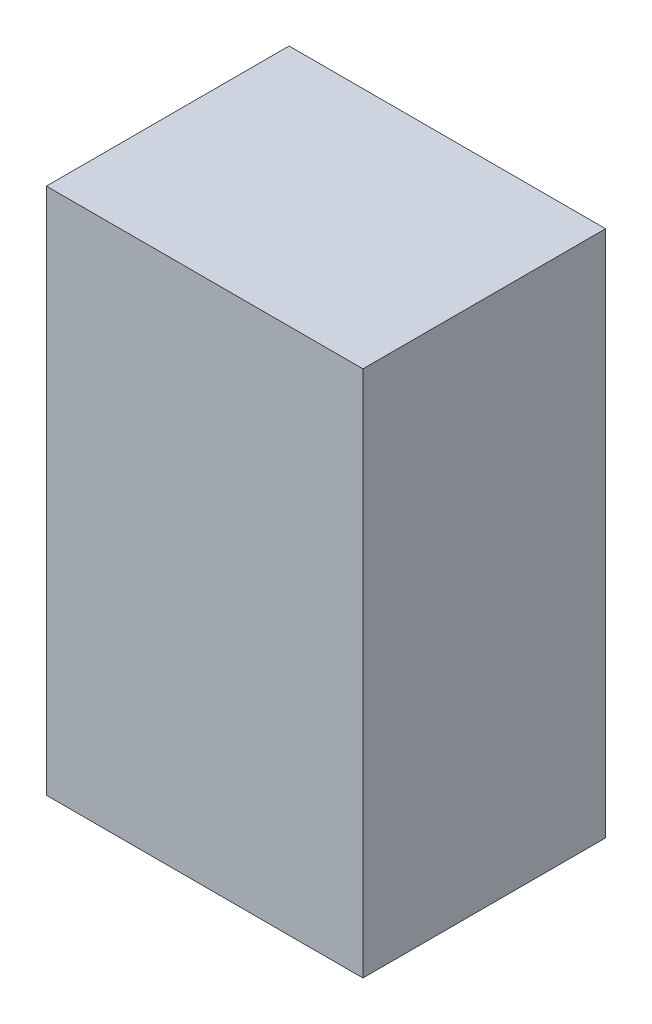
from build123d import *

# Parameters (mm, degrees)
SKETCH1_W           = 30
SKETCH1_H           = 23
BOSS_EXTRUDE1_DEPTH = 50
CUT_EXTRUDE2_START  = 2.5
SKETCH1_5_W         = 25
SKETCH1_5_H         = 18
CUT_EXTRUDE2_DEPTH  = 45
BOSS_EXTRUDE3_START = 25
SKETCH1_6_W         = 25
SKETCH1_6_H         = 18
BOSS_EXTRUDE3_DEPTH = 1
CUT_EXTRUDE3_START  = 21.5
SKETCH2_R           = 2.5
CUT_EXTRUDE3_DEPTH  = 26
SKETCH4_W           = 25
SKETCH4_H           = 5
CUT_EXTRUDE4_DEPTH  = 1


with BuildPart() as part:
    # Sketch1 → Boss-Extrude1 (new body)
    with BuildSketch(Plane(origin=(0, 0, 0), x_dir=(1, 0, 0), z_dir=(0, 1, 0))):
        Rectangle(SKETCH1_W, SKETCH1_H)
    extrude(amount=BOSS_EXTRUDE1_DEPTH)

    # Sketch1<5> → Cut-Extrude2 (cut)
    with BuildSketch(Plane(origin=(0, 0, 0), x_dir=(1, 0, 0), z_dir=(0, 1, 0)).offset(CUT_EXTRUDE2_START)):
        Rectangle(SKETCH1_5_W, SKETCH1_5_H)
    extrude(amount=CUT_EXTRUDE2_DEPTH, mode=Mode.SUBTRACT)

    # Sketch1<6> → Boss-Extrude3 (add)
    with BuildSketch(Plane(origin=(0, 0, 0), x_dir=(1, 0, 0), z_dir=(0, 1, 0)).offset(BOSS_EXTRUDE3_START)):
        Rectangle(SKETCH1_6_W, SKETCH1_6_H)
    extrude(amount=BOSS_EXTRUDE3_DEPTH)

    # Sketch2 → Cut-Extrude3 (cut)
    with BuildSketch(Plane(origin=(0, 47.5, 0), x_dir=(-1, 0, 0), z_dir=(0, -1, 0)).offset(CUT_EXTRUDE3_START)):
        with Locations(Location((0, -6, 0), (0, 0, 270))):
            Circle(SKETCH2_R)
    extrude(amount=CUT_EXTRUDE3_DEPTH, mode=Mode.SUBTRACT)

    # Sketch4 → Cut-Extrude4 (cut)
    with BuildSketch(Plane(origin=(0, 26, 0), x_dir=(1, 0, 0), z_dir=(0, 1, 0))):
        with Locations((0, -6.5)):
            Rectangle(SKETCH4_W, SKETCH4_H)
    extrude(amount=-CUT_EXTRUDE4_DEPTH, mode=Mode.SUBTRACT)


solid = part.part
